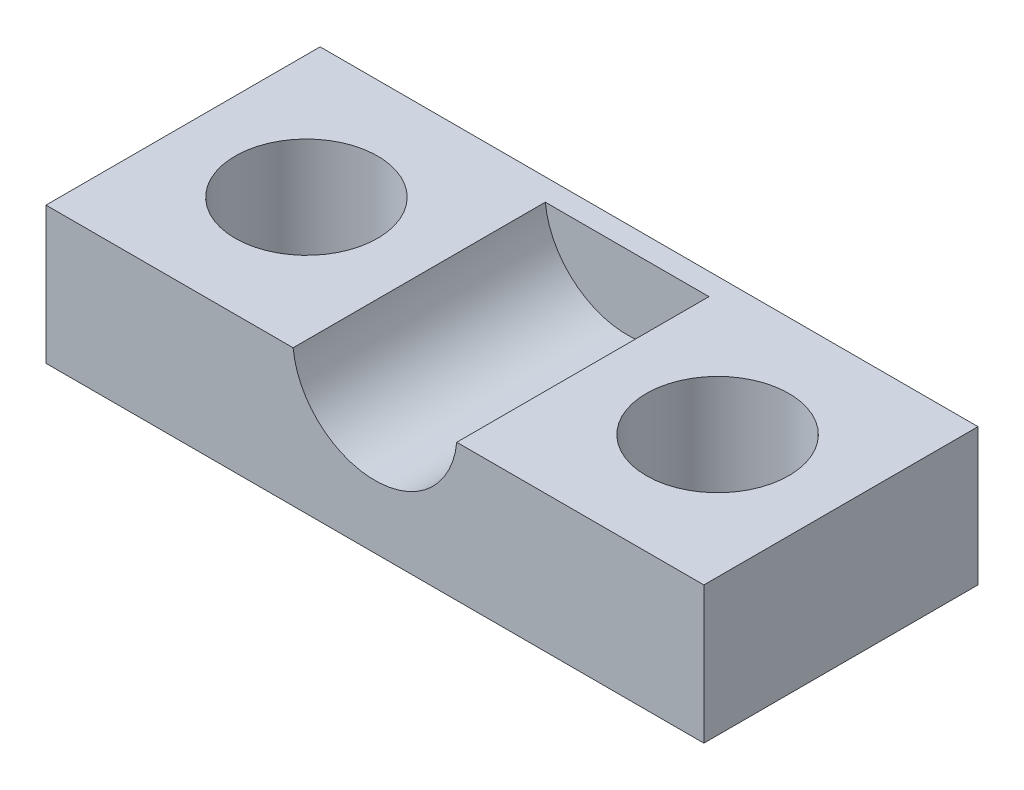
from build123d import *

# Parameters (mm, degrees)
SKETCH1_W           = 24
SKETCH1_H           = 10
SKETCH1_R           = 2.6
BOSS_EXTRUDE1_DEPTH = 5
SKETCH2_R           = 3
CUT_EXTRUDE1_DEPTH  = 9.2


with BuildPart() as part:
    # Sketch1 → Boss-Extrude1 (new body)
    with BuildSketch(Plane(origin=(0, 0, 0), x_dir=(1, 0, 0), z_dir=(0, 1, 0))):
        with Locations((12, 5)):
            Rectangle(SKETCH1_W, SKETCH1_H)
        with Locations(Location((4.5, 5, 0), (0, 0, 270))):
            Circle(SKETCH1_R, mode=Mode.SUBTRACT)
        with Locations(Location((19.5, 5, 0), (0, 0, 270))):
            Circle(SKETCH1_R, mode=Mode.SUBTRACT)
    extrude(amount=BOSS_EXTRUDE1_DEPTH)

    # Sketch2 → Cut-Extrude1 (cut)
    with BuildSketch(Plane.XY):
        with Locations((12, 5.3)):
            Circle(SKETCH2_R)
    extrude(amount=-CUT_EXTRUDE1_DEPTH, mode=Mode.SUBTRACT)


solid = part.part
